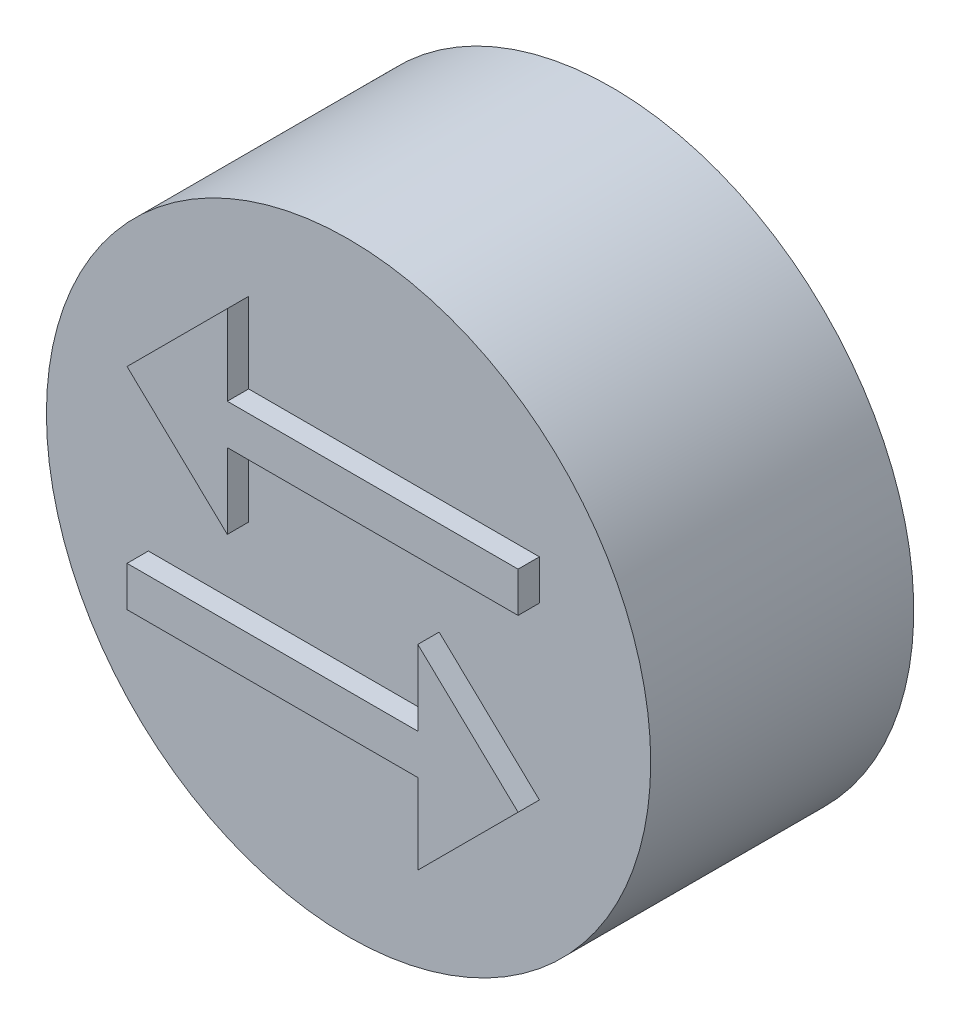
from build123d import *

# Parameters (mm, degrees)
SKETCH1_R           = 8.5
BOSS_EXTRUDE1_DEPTH = 4.4
SKETCH3_R           = 5.8
CUT_EXTRUDE1_DEPTH  = 4
BOSS_EXTRUDE3_START = 3
SKETCH4_R           = 8.5
SKETCH4_R_2         = 7.5
BOSS_EXTRUDE3_DEPTH = 3
BOSS_EXTRUDE4_DEPTH = 0.6


with BuildPart() as part:
    # Sketch1 → Boss-Extrude1 (new body)
    with BuildSketch(Plane.XY):
        Circle(SKETCH1_R)
    extrude(amount=BOSS_EXTRUDE1_DEPTH)

    # Sketch3 → Cut-Extrude1 (cut)
    with BuildSketch(Plane(origin=(0, 0, 0), x_dir=(-1, 0, 0), z_dir=(0, 0, -1))):
        Circle(SKETCH3_R)
    extrude(amount=-CUT_EXTRUDE1_DEPTH, mode=Mode.SUBTRACT)

    # Sketch4 → Boss-Extrude3 (add)
    with BuildSketch(Plane(origin=(0, 0, 0), x_dir=(-1, 0, 0), z_dir=(0, 0, -1)).offset(BOSS_EXTRUDE3_START)):
        Circle(SKETCH4_R)
        Circle(SKETCH4_R_2, mode=Mode.SUBTRACT)
    extrude(amount=-BOSS_EXTRUDE3_DEPTH)

    # Sketch6 → Cut-Revolve1 (revolve, cut)
    with BuildSketch(Plane(origin=(0, 0, 0), x_dir=(1, 0, 0), z_dir=(0, 1, 0)), mode=Mode.PRIVATE) as cut_revolve1_sk:
        Polygon((7.5, 0), (5.8, -1.7), (5.8, 0), align=None)
    revolve(cut_revolve1_sk.sketch.rotate(Axis((0, 0, -5.5), (0, 0, 1)), 180), axis=Axis((0, 0, -5.5), (0, 0, 1)), mode=Mode.SUBTRACT)

    # Sketch2 → Boss-Extrude4 (add)
    with BuildSketch(Plane.XY.offset(4.4)):
        Polygon((-5.631532004, 2.878926263), (-2.811019183, 5.699439083), (-2.811019183, 3.443028827), (5.368467996, 3.443028827), (5.368467996, 2.314823699), (-2.811019183, 2.314823699), (-2.811019183, 0.199439083), align=None)
        Polygon((5.368467996, -2.480048096), (2.547955176, -5.300560917), (2.547955176, -3.04415066), (-5.631532004, -3.04415066), (-5.631532004, -1.915945532), (2.547955176, -1.915945532), (2.547955176, 0.199439083), align=None)
    extrude(amount=BOSS_EXTRUDE4_DEPTH)


solid = part.part
